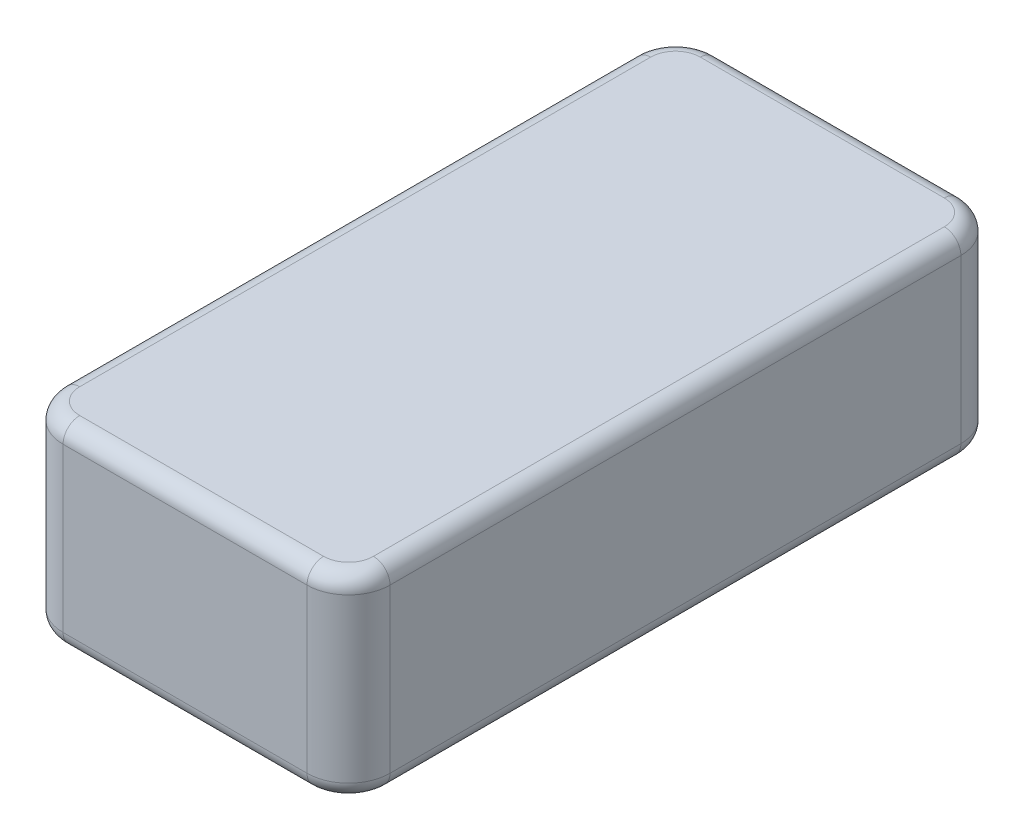
from build123d import *

# Parameters (mm, degrees)
SKETCH1_W           = 5
SKETCH1_H           = 10
BOSS_EXTRUDE1_DEPTH = 3
FILLET1_R           = 0.635
FILLET2_R           = 0.254


with BuildPart() as part:
    # Sketch1 → Boss-Extrude1 (new body)
    with BuildSketch(Plane(origin=(0, 0, 0), x_dir=(1, 0, 0), z_dir=(0, 1, 0))):
        with Locations((2.5, 5)):
            Rectangle(SKETCH1_W, SKETCH1_H)
    extrude(amount=BOSS_EXTRUDE1_DEPTH)

    # Fillet1
    fillet1_edges = [part.edges().sort_by_distance(p)[0] for p in [
        (0, 1.5, -10),
        (5, 1.5, -10),
        (5, 1.5, 0),
        (0, 1.5, 0),
    ]]
    fillet(fillet1_edges, radius=FILLET1_R)

    # Fillet2
    fillet2_edges = [part.edges().sort_by_distance(p)[0] for p in [
        (0, 0, -5),
        (0, 3, -5),
        (2.5, 0, -10),
        (5, 0, -5),
        (2.5, 0, 0),
        (0.185987194, 0, -0.185987194),
        (4.814012806, 0, -0.185987194),
        (4.814012806, 0, -9.814012806),
        (0.185987194, 0, -9.814012806),
        (2.5, 3, -10),
        (2.5, 3, 0),
        (5, 3, -5),
        (0.185987194, 3, -0.185987194),
        (4.814012806, 3, -0.185987194),
        (4.814012806, 3, -9.814012806),
        (0.185987194, 3, -9.814012806),
    ]]
    fillet(fillet2_edges, radius=FILLET2_R)


solid = part.part
